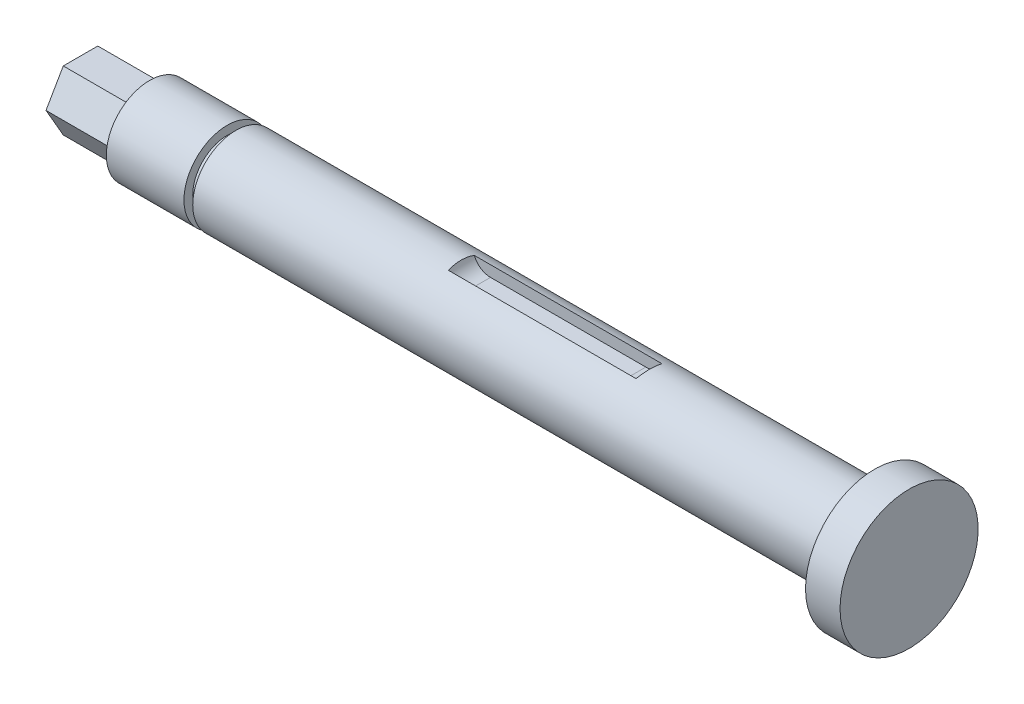
from build123d import *

# Parameters (mm, degrees)
KEYWAY_DEPTH               = 2.38125
HEXAGONAL_SKETCH_OUTSIDE_W = 58.716
HEXAGONAL_SKETCH_OUTSIDE_H = 58.716
HEXAGONAL_CUT_DEPTH        = 12.7


with BuildPart() as part:
    # Base Sketch → Base (revolve)
    with BuildSketch(Plane.XY, mode=Mode.PRIVATE) as base_sk:
        Polygon((0, 0), (152.4, 0), (152.4, 12.7), (146.05, 12.7), (146.05, 7.9375), (28.575, 7.9375), (28.575, 6.3373), (26.9748, 6.3373), (26.9748, 7.9502), (12.7, 7.9502), (12.7, 6.35), (0, 6.35), align=None)
    revolve(base_sk.sketch.rotate(Axis((-28.230722892, 0, 0), (1, 0, 0)), 90), axis=Axis((-28.230722892, 0, 0), (1, 0, 0)))

    # Keyway Sketch → Keyway (cut, symmetric)
    with BuildSketch(Plane.XY):
        with BuildLine():
            Line((69.85, 14.2875), (104.775, 14.2875))
            Line((104.775, 14.2875), (104.775, 8.7249))
            ThreePointArc((104.775, 8.7249), (103.84506403, 6.47983597), (101.6, 5.5499))
            Line((101.6, 5.5499), (73.025, 5.5499))
            ThreePointArc((73.025, 5.5499), (70.77993597, 6.47983597), (69.85, 8.7249))
            Line((69.85, 8.7249), (69.85, 14.2875))
        make_face()
    extrude(amount=KEYWAY_DEPTH, both=True, mode=Mode.SUBTRACT)

    # Hexagonal Sketch outside → Hexagonal Cut (cut)
    with BuildSketch(Plane.ZY):
        Rectangle(HEXAGONAL_SKETCH_OUTSIDE_W, HEXAGONAL_SKETCH_OUTSIDE_H)
        Polygon((3.175, 5.499261314), (-3.175, 5.499261314), (-6.35, 0), (-3.175, -5.499261314), (3.175, -5.499261314), (6.35, 0), align=None, mode=Mode.SUBTRACT)
    extrude(amount=-HEXAGONAL_CUT_DEPTH, mode=Mode.SUBTRACT)


solid = part.part
